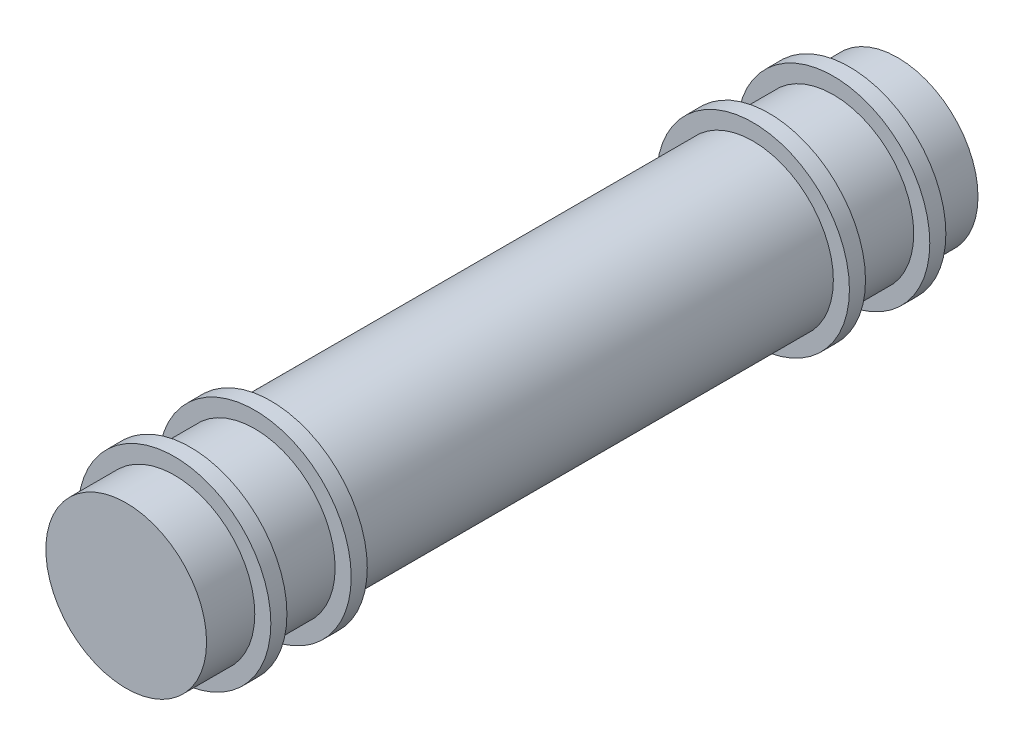
from build123d import *

# Parameters (mm, degrees)
ESBO_O1_R                = 2.5
RESSALTO_EXTRUS_O1_DEPTH = 24
ESBO_O2_W                = 0.5
ESBO_O2_H                = 3
ESBO_O4_W                = 0.5
ESBO_O4_H                = 3


with BuildPart() as part:
    # Esboço1 → Ressalto-extrusão1 (new body)
    with BuildSketch(Plane.XY):
        Circle(ESBO_O1_R)
    extrude(amount=RESSALTO_EXTRUS_O1_DEPTH)

    # Esboço2 → Revolução1 (revolve)
    with BuildSketch(Plane(origin=(0, 0, 0), x_dir=(0, 0, -1), z_dir=(1, 0, 0)), mode=Mode.PRIVATE) as revolu_o1_sk:
        with Locations((-1.75, -1.5)):
            Rectangle(ESBO_O2_W, ESBO_O2_H)
        with Locations((-4.25, -1.5)):
            Rectangle(ESBO_O2_W, ESBO_O2_H)
    revolve(revolu_o1_sk.sketch.rotate(Axis((0, 0, 2), (0, 0, -1)), 270), axis=Axis((0, 0, 2), (0, 0, -1)))

    # Esboço4 → Revolução2 (revolve)
    with BuildSketch(Plane(origin=(0, 0, 0), x_dir=(0, 0, -1), z_dir=(1, 0, 0)), mode=Mode.PRIVATE) as revolu_o2_sk:
        with Locations((-19.75, -1.5)):
            Rectangle(ESBO_O4_W, ESBO_O4_H)
        with Locations((-22.25, -1.5)):
            Rectangle(ESBO_O4_W, ESBO_O4_H)
    revolve(revolu_o2_sk.sketch.rotate(Axis((0, 0, 20), (0, 0, -1)), 90), axis=Axis((0, 0, 20), (0, 0, -1)))


solid = part.part
